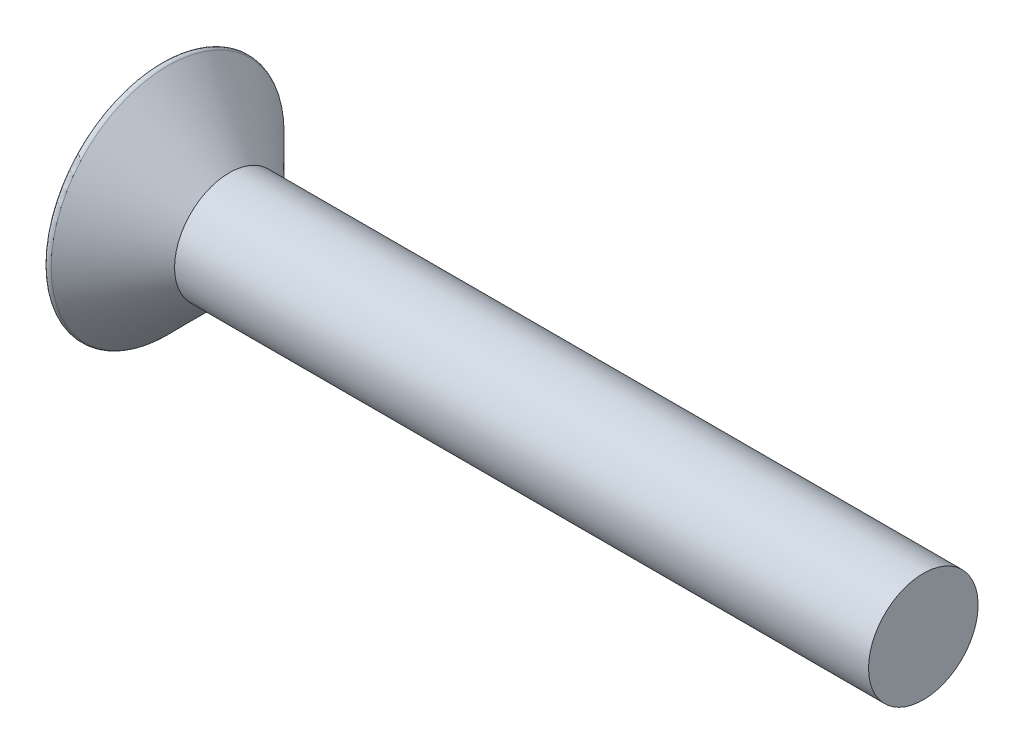
from build123d import *

# Parameters (mm, degrees)
CONG_1_R = 0.1


with BuildPart() as part:
    # Esquisse1 → Révolution1 (revolve)
    with BuildSketch(Plane.XY, mode=Mode.PRIVATE) as r_volution1_sk:
        Polygon((0, 0), (0, 3.36), (1.86, 1.5), (20.86, 1.5), (20.86, 0), align=None)
    revolve(r_volution1_sk.sketch.rotate(Axis((0, 0, 0), (1, 0, 0)), 90), axis=Axis((0, 0, 0), (1, 0, 0)))

    # Congé1
    cong_1_edges = [part.edges().sort_by_distance(p)[0] for p in [
        (0, 0, -3.36),
    ]]
    fillet(cong_1_edges, radius=CONG_1_R)


solid = part.part
